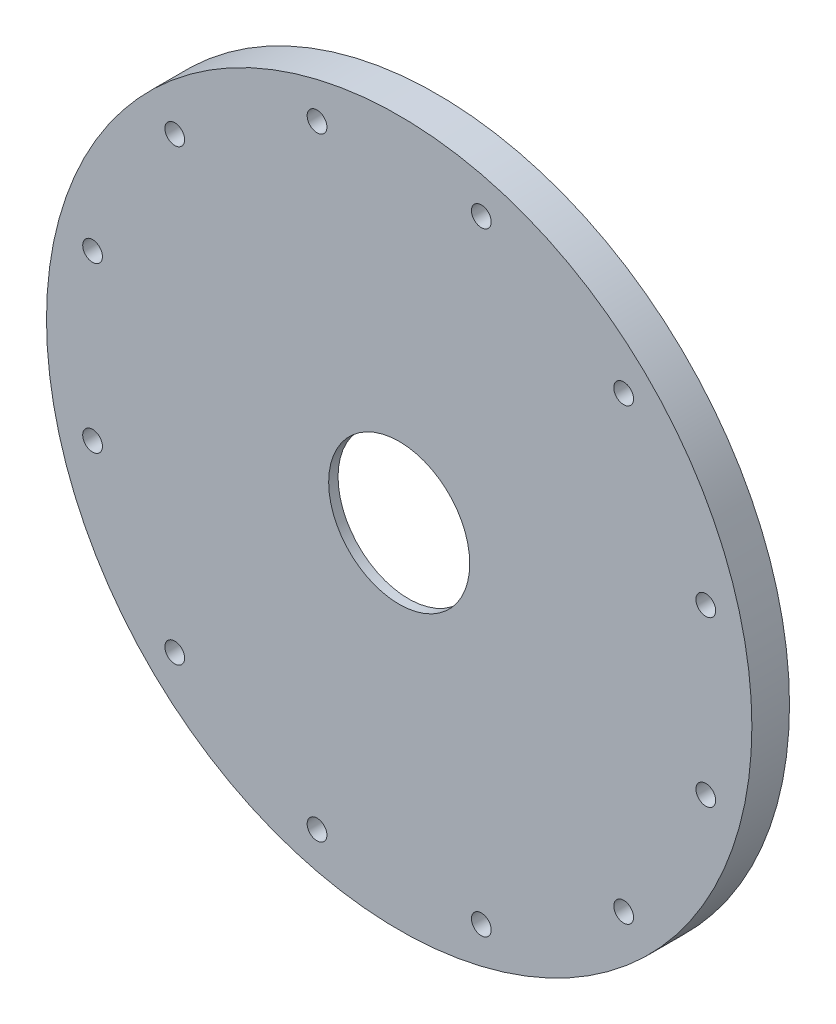
from build123d import *

# Parameters (mm, degrees)
SKETCH1_R             = 75
BOSS_EXTRUDE1_DEPTH   = 8
M5X0_8_TAPPED_HOLE1_D = 4.2
SKETCH11_R            = 50.2
CUT_EXTRUDE3_DEPTH    = 6
SKETCH12_R            = 58.6475
SKETCH12_R_2          = 53.6575
CUT_EXTRUDE4_DEPTH    = 4
SKETCH13_R            = 15
CUT_EXTRUDE5_DEPTH    = 2


with BuildPart() as part:
    # Sketch1 → Boss-Extrude1 (new body)
    with BuildSketch(Plane.XY):
        Circle(SKETCH1_R)
    extrude(amount=BOSS_EXTRUDE1_DEPTH)

    # M5x0.8 Tapped Hole1 (through all)
    with Locations(Plane(origin=(0, 0, 0), x_dir=(-1, 0, 0), z_dir=(0, 0, -1))):
        with Locations((-17.470285544, -65.199993275), (-47.72970773, 47.72970773), (65.199993275, -17.470285544), (47.72970773, -47.72970773), (-65.199993275, 17.470285544), (-17.470285544, 65.199993275), (-65.199993275, -17.470285544), (-47.72970773, -47.72970773), (17.470285544, -65.199993275), (65.199993275, 17.470285544), (47.72970773, 47.72970773), (17.470285544, 65.199993275)):
            Hole(M5X0_8_TAPPED_HOLE1_D / 2)

    # Sketch11 → Cut-Extrude3 (cut)
    with BuildSketch(Plane(origin=(0, 0, 0), x_dir=(-1, 0, 0), z_dir=(0, 0, -1))):
        Circle(SKETCH11_R)
    extrude(amount=-CUT_EXTRUDE3_DEPTH, mode=Mode.SUBTRACT)

    # Sketch12 → Cut-Extrude4 (cut)
    with BuildSketch(Plane(origin=(0, 0, 0), x_dir=(-1, 0, 0), z_dir=(0, 0, -1))):
        Circle(SKETCH12_R)
        Circle(SKETCH12_R_2, mode=Mode.SUBTRACT)
    extrude(amount=-CUT_EXTRUDE4_DEPTH, mode=Mode.SUBTRACT)

    # Sketch13 → Cut-Extrude5 (cut)
    with BuildSketch(Plane(origin=(0, 0, 6), x_dir=(-1, 0, 0), z_dir=(0, 0, -1))):
        Circle(SKETCH13_R)
    extrude(amount=-CUT_EXTRUDE5_DEPTH, mode=Mode.SUBTRACT)


solid = part.part
